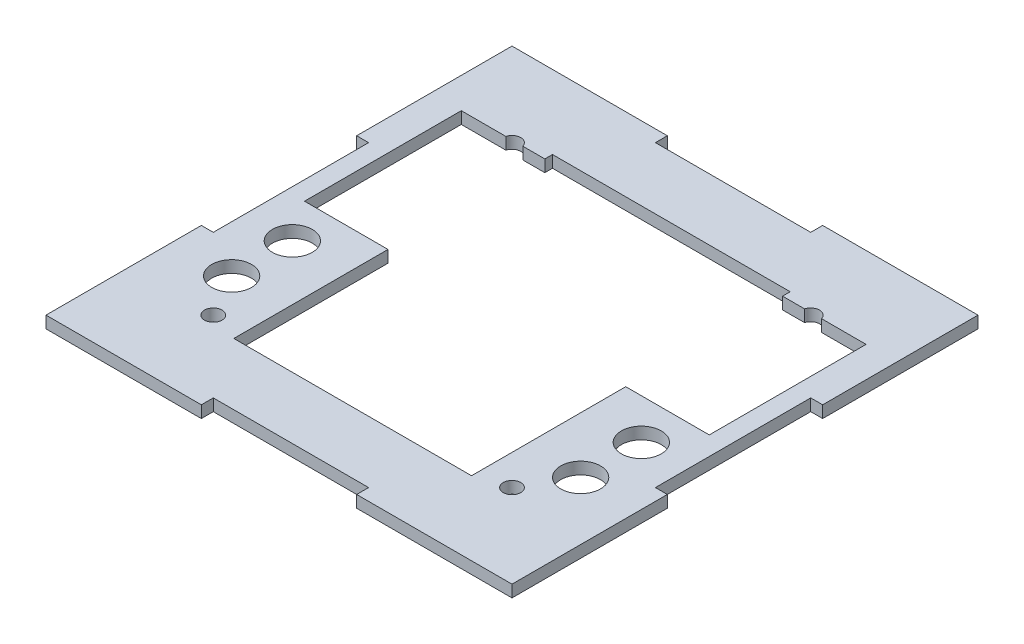
from build123d import *

# Parameters (mm, degrees)
SKETCH1_R           = 2.2
BOSS_EXTRUDE1_DEPTH = 3
SKETCH3_W           = 19.05
SKETCH3_H           = 19.05
SKETCH3_R           = 2.2
SKETCH3_R_2         = 5
CUT_EXTRUDE1_DEPTH  = 83.785868359
CUT_EXTRUDE2_DEPTH  = 10


with BuildPart() as part:
    # Sketch1 → Boss-Extrude1 (new body)
    with BuildSketch(Plane(origin=(0, 0, 0), x_dir=(1, 0, 0), z_dir=(0, 1, 0))):
        Polygon((-58.5, 19.5), (-58.5, 58.5), (-19.5, 58.5), (-19.5, 55.5), (19.5, 55.5), (19.5, 58.5), (58.5, 58.5), (58.5, 19.5), (55.5, 19.5), (55.5, -19.5), (58.5, -19.5), (58.5, -58.5), (19.5, -58.5), (19.5, -55.5), (-19.5, -55.5), (-19.5, -58.5), (-58.5, -58.5), (-58.5, -19.5), (-55.5, -19.5), (-55.5, 19.5), align=None)
        with Locations(Location((-37.5, 37.5, 0), (0, 0, 270))):
            Circle(SKETCH1_R, mode=Mode.SUBTRACT)
        with Locations(Location((37.5, 37.5, 0), (0, 0, 270))):
            Circle(SKETCH1_R, mode=Mode.SUBTRACT)
        with Locations(Location((37.5, -37.5, 0), (0, 0, 270))):
            Circle(SKETCH1_R, mode=Mode.SUBTRACT)
        with Locations(Location((-37.5, -37.5, 0), (0, 0, 270))):
            Circle(SKETCH1_R, mode=Mode.SUBTRACT)
    extrude(amount=BOSS_EXTRUDE1_DEPTH)

    # Sketch3 → Cut-Extrude1 (cut, through all)
    with BuildSketch(Plane(origin=(0, 3, 0), x_dir=(1, 0, 0), z_dir=(0, 1, 0))):
        with Locations((20.32, 30.48)):
            Rectangle(SKETCH3_W, SKETCH3_H)
        with Locations((20.32, 10.16)):
            Rectangle(SKETCH3_W, SKETCH3_H)
        with Locations((20.32, -10.16)):
            Rectangle(SKETCH3_W, SKETCH3_H)
        with Locations((20.32, -30.48)):
            Rectangle(SKETCH3_W, SKETCH3_H)
        with Locations((0, -30.48)):
            Rectangle(SKETCH3_W, SKETCH3_H)
        with Locations((0, -10.16)):
            Rectangle(SKETCH3_W, SKETCH3_H)
        with Locations((0, 10.16)):
            Rectangle(SKETCH3_W, SKETCH3_H)
        with Locations((0, 30.48)):
            Rectangle(SKETCH3_W, SKETCH3_H)
        with Locations((-20.32, 30.48)):
            Rectangle(SKETCH3_W, SKETCH3_H)
        with Locations((-20.32, 10.16)):
            Rectangle(SKETCH3_W, SKETCH3_H)
        with Locations((-20.32, -10.16)):
            Rectangle(SKETCH3_W, SKETCH3_H)
        with Locations((-20.32, -30.48)):
            Rectangle(SKETCH3_W, SKETCH3_H)
        with Locations((-37.5, 37.5)):
            Circle(SKETCH3_R)
        with Locations((-41.29, 28.56)):
            Rectangle(SKETCH3_W, SKETCH3_H)
        with Locations((-41.29, 8.24)):
            Rectangle(SKETCH3_W, SKETCH3_H)
        with Locations((37.5, 37.5)):
            Circle(SKETCH3_R)
        with Locations((41.29, 28.56)):
            Rectangle(SKETCH3_W, SKETCH3_H)
        with Locations((41.29, 8.24)):
            Rectangle(SKETCH3_W, SKETCH3_H)
        with Locations(Location((-43.718159869, -11.432070866, 0), (0, 0, 270))):
            Circle(SKETCH3_R_2)
        with Locations(Location((-43.718159869, -26.672070866, 0), (0, 0, 270))):
            Circle(SKETCH3_R_2)
        with Locations(Location((43.901840131, -11.432070866, 0), (0, 0, 270))):
            Circle(SKETCH3_R_2)
        with Locations(Location((43.901840131, -26.672070866, 0), (0, 0, 270))):
            Circle(SKETCH3_R_2)
    extrude(amount=-CUT_EXTRUDE1_DEPTH, mode=Mode.SUBTRACT)

    # Sketch4 → Cut-Extrude2 (cut)
    with BuildSketch(Plane(origin=(0, 3, 0), x_dir=(1, 0, 0), z_dir=(0, 1, 0))):
        Polygon((-31.765, -1.285), (-29.845, -1.285), (-29.845, -40.005), (29.845, -40.005), (29.845, -1.285), (50.815, -1.285), (50.815, 38.085), (29.845, 38.085), (10.795, 40.005), (-10.795, 40.005), (-29.845, 38.085), (-31.765, 38.085), (-50.815, 19.035), (-50.815, 17.765), align=None)
    extrude(amount=-CUT_EXTRUDE2_DEPTH, mode=Mode.SUBTRACT)


solid = part.part
